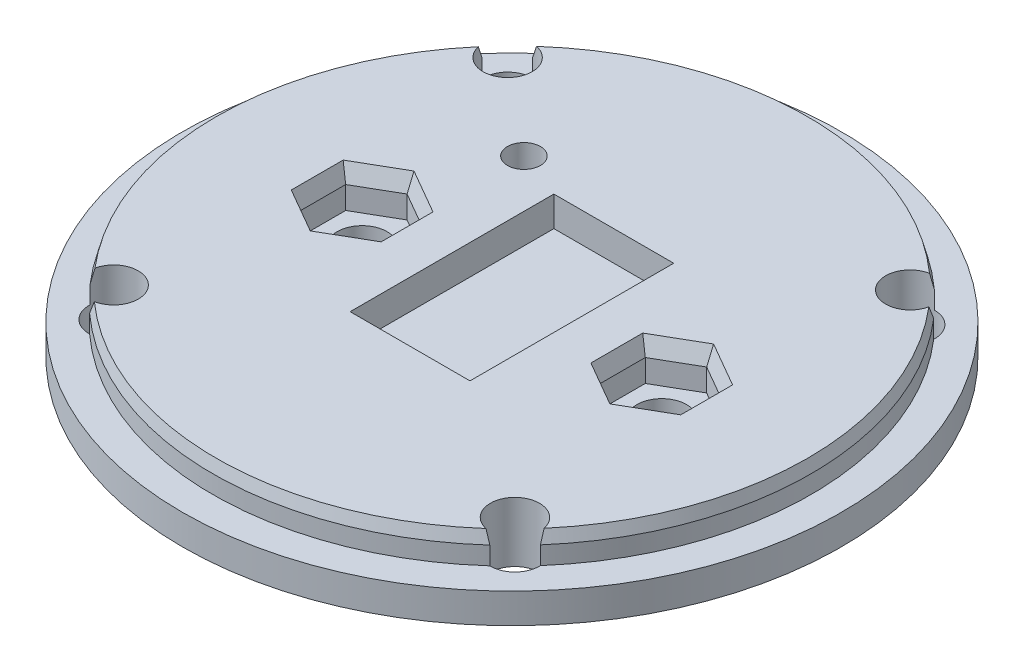
from build123d import *
from OCP.BRepFilletAPI import BRepFilletAPI_MakeChamfer

# Parameters (mm, degrees)
SKETCH_1_R          = 55
EXTRUDE_1_DEPTH     = 5
SKETCH_2_R          = 49.9
EXTRUDE_2_DEPTH     = 5
SKETCH_3_W          = 35
SKETCH_3_H          = 30
EXTRUDE_3_DEPTH     = 25
SKETCH_4_W          = 20.2
SKETCH_4_H          = 10.3
CUT_EXTRUDE_1_DEPTH = 93.466210045
SKETCH_5_R          = 4.1
CUT_EXTRUDE_2_DEPTH = 82.700673192
SKETCH_6_R          = 2.75
CUT_EXTRUDE_3_DEPTH = 86.293610546
CHAMFER1_SIZE       = 2
CHAMFER1_SIZE2      = 0.535898385
SKETCH2_W           = 35
SKETCH2_H           = 30
CUT_EXTRUDE1_DEPTH  = 12.5
BOSS_EXTRUDE1_START = -2
SKETCH4_W           = 70
SKETCH4_H           = 20
BOSS_EXTRUDE1_DEPTH = 5.35
SKETCH5_R           = 4.15
CUT_EXTRUDE2_DEPTH  = 80.281917882
CUT_EXTRUDE3_DEPTH  = 6.5
SKETCH7_W           = 20
SKETCH7_H           = 34
CUT_EXTRUDE4_DEPTH  = 5
CHAMFER2_SIZE       = 1
CHAMFER2_SIZE2      = 2.747477419


with BuildPart() as part:
    # Эскиз1 → Бобышка-Вытянуть1 (new body)
    with BuildSketch(Plane(origin=(0, 0, 0), x_dir=(1, 0, 0), z_dir=(0, 1, 0))):
        with Locations(Location((0, 0, 0), (0, 0, 270))):
            Circle(SKETCH_1_R)
    extrude(amount=EXTRUDE_1_DEPTH)

    # Эскиз2 → Бобышка-Вытянуть2 (add)
    with BuildSketch(Plane(origin=(0, 5, 0), x_dir=(1, 0, 0), z_dir=(0, 1, 0))):
        with Locations(Location((0, 0, 0), (0, 0, 270))):
            Circle(SKETCH_2_R)
    extrude(amount=EXTRUDE_2_DEPTH)

    # Эскиз3 → Бобышка-Вытянуть3 (add)
    with BuildSketch(Plane.XZ):
        Rectangle(SKETCH_3_W, SKETCH_3_H)
    extrude(amount=EXTRUDE_3_DEPTH)

    # Эскиз4 → Вырез-Вытянуть1 (cut, through all)
    with BuildSketch(Plane.XY.offset(15)):
        with Locations((0, -12.5)):
            Rectangle(SKETCH_4_W, SKETCH_4_H)
    extrude(amount=-CUT_EXTRUDE_1_DEPTH, mode=Mode.SUBTRACT)

    # Эскиз5 → Вырез-Вытянуть2 (cut, through all)
    with BuildSketch(Plane.XZ):
        with Locations(Location((33.592198598, -32.871936263, 0), (0, 0, 270))):
            Circle(SKETCH_5_R)
        with Locations(Location((-33.591727056, -32.872418125, 0), (0, 0, 270))):
            Circle(SKETCH_5_R)
        with Locations(Location((-33.591727056, 32.872418125, 0), (0, 0, 270))):
            Circle(SKETCH_5_R)
        with Locations(Location((33.483215177, 32.983215177, 0), (0, 0, 270))):
            Circle(SKETCH_5_R)
    extrude(amount=-CUT_EXTRUDE_2_DEPTH, mode=Mode.SUBTRACT)

    # Эскиз6 → Вырез-Вытянуть3 (cut, through all)
    with BuildSketch(Plane(origin=(0, 10, 0), x_dir=(1, 0, 0), z_dir=(0, 1, 0))):
        with Locations(Location((-17.999856554, 19.999999999, 0), (0, 0, 270))):
            Circle(SKETCH_6_R)
    extrude(amount=-CUT_EXTRUDE_3_DEPTH, mode=Mode.SUBTRACT)

    # Chamfer1: one chamfer whose edges measure the first distance from different faces: ONE call of the kernel's chamfer builder (chamfer() names one face for all edges)
    chamfer1_edges_1 = [part.edges().sort_by_distance(p)[0] for p in [
        (0.000357897, 10, -49.899999999),
    ]]
    chamfer1_side_1 = [part.faces().sort_by_distance(p)[0] for p in [
        (0.000357897, 7.5, -49.899999999),
    ]]
    chamfer1_edges_2 = [part.edges().sort_by_distance(p)[0] for p in [
        (-49.9, 10, 0),
    ]]
    chamfer1_side_2 = [part.faces().sort_by_distance(p)[0] for p in [
        (-49.9, 7.5, 0),
    ]]
    chamfer1_edges_3 = [part.edges().sort_by_distance(p)[0] for p in [
        (-0.08242255, 10, 49.899931929),
    ]]
    chamfer1_side_3 = [part.faces().sort_by_distance(p)[0] for p in [
        (-0.08242255, 7.5, 49.899931929),
    ]]
    chamfer1_edges_4 = [part.edges().sort_by_distance(p)[0] for p in [
        (49.899931657, 10, 0.082587101),
    ]]
    chamfer1_side_4 = [part.faces().sort_by_distance(p)[0] for p in [
        (49.899931657, 7.5, 0.082587101),
    ]]
    chamfer1 = BRepFilletAPI_MakeChamfer(part.part.solid().wrapped)
    for e in chamfer1_edges_1:
        chamfer1.Add(CHAMFER1_SIZE, CHAMFER1_SIZE2, e.wrapped, chamfer1_side_1[0].wrapped)  # the first distance lies on this face
    for e in chamfer1_edges_2:
        chamfer1.Add(CHAMFER1_SIZE, CHAMFER1_SIZE2, e.wrapped, chamfer1_side_2[0].wrapped)  # the first distance lies on this face
    for e in chamfer1_edges_3:
        chamfer1.Add(CHAMFER1_SIZE, CHAMFER1_SIZE2, e.wrapped, chamfer1_side_3[0].wrapped)  # the first distance lies on this face
    for e in chamfer1_edges_4:
        chamfer1.Add(CHAMFER1_SIZE, CHAMFER1_SIZE2, e.wrapped, chamfer1_side_4[0].wrapped)  # the first distance lies on this face
    add(Compound.cast(chamfer1.Shape()), mode=Mode.REPLACE)

    # Sketch2 → Cut-Extrude1 (cut)
    with BuildSketch(Plane.XZ.offset(25)):
        Rectangle(SKETCH2_W, SKETCH2_H)
    extrude(amount=-CUT_EXTRUDE1_DEPTH, mode=Mode.SUBTRACT)

    # Sketch4 → Boss-Extrude1 (add)
    with BuildSketch(Plane.XZ.offset(7.35).offset(BOSS_EXTRUDE1_START)):
        Rectangle(SKETCH4_W, SKETCH4_H)
    extrude(amount=-BOSS_EXTRUDE1_DEPTH)

    # Sketch5 → Cut-Extrude2 (cut, through all)
    with BuildSketch(Plane.XZ.offset(5.35)):
        with Locations((25, 0)):
            Circle(SKETCH5_R)
        with Locations((-25, 0)):
            Circle(SKETCH5_R)
    extrude(amount=-CUT_EXTRUDE2_DEPTH, mode=Mode.SUBTRACT)

    # Sketch6 → Cut-Extrude3 (cut)
    with BuildSketch(Plane(origin=(0, 10, 0), x_dir=(1, 0, 0), z_dir=(0, 1, 0))):
        Polygon((-18.504809472, 3.75), (-25, 7.5), (-31.495190528, 3.75), (-31.495190528, -3.75), (-25, -7.5), (-18.504809472, -3.75), align=None)
        Polygon((31.495190528, 3.75), (25, 7.5), (18.504809472, 3.75), (18.504809472, -3.75), (25, -7.5), (31.495190528, -3.75), align=None)
    extrude(amount=-CUT_EXTRUDE3_DEPTH, mode=Mode.SUBTRACT)

    # Sketch7 → Cut-Extrude4 (cut)
    with BuildSketch(Plane(origin=(0, 10, 0), x_dir=(1, 0, 0), z_dir=(0, 1, 0))):
        Rectangle(SKETCH7_W, SKETCH7_H)
    extrude(amount=-CUT_EXTRUDE4_DEPTH, mode=Mode.SUBTRACT)

    # Chamfer2
    chamfer2_edges = [part.edges().sort_by_distance(p)[0] for p in [
        (-18.504809472, 10, 0),
        (-21.752404736, 10, -5.625),
        (-28.247595264, 10, -5.625),
        (-31.495190528, 10, 0),
        (-28.247595264, 10, 5.625),
        (-21.752404736, 10, 5.625),
        (31.495190528, 10, 0),
        (28.247595264, 10, -5.625),
        (21.752404736, 10, -5.625),
        (18.504809472, 10, 0),
        (21.752404736, 10, 5.625),
        (28.247595264, 10, 5.625),
    ]]
    chamfer2_side = [part.faces().sort_by_distance(p)[0] for p in [
        (-28.121658773, 10, 32.336814493),
    ]]
    chamfer(chamfer2_edges, length=CHAMFER2_SIZE, length2=CHAMFER2_SIZE2, reference=chamfer2_side[0])


solid = part.part
